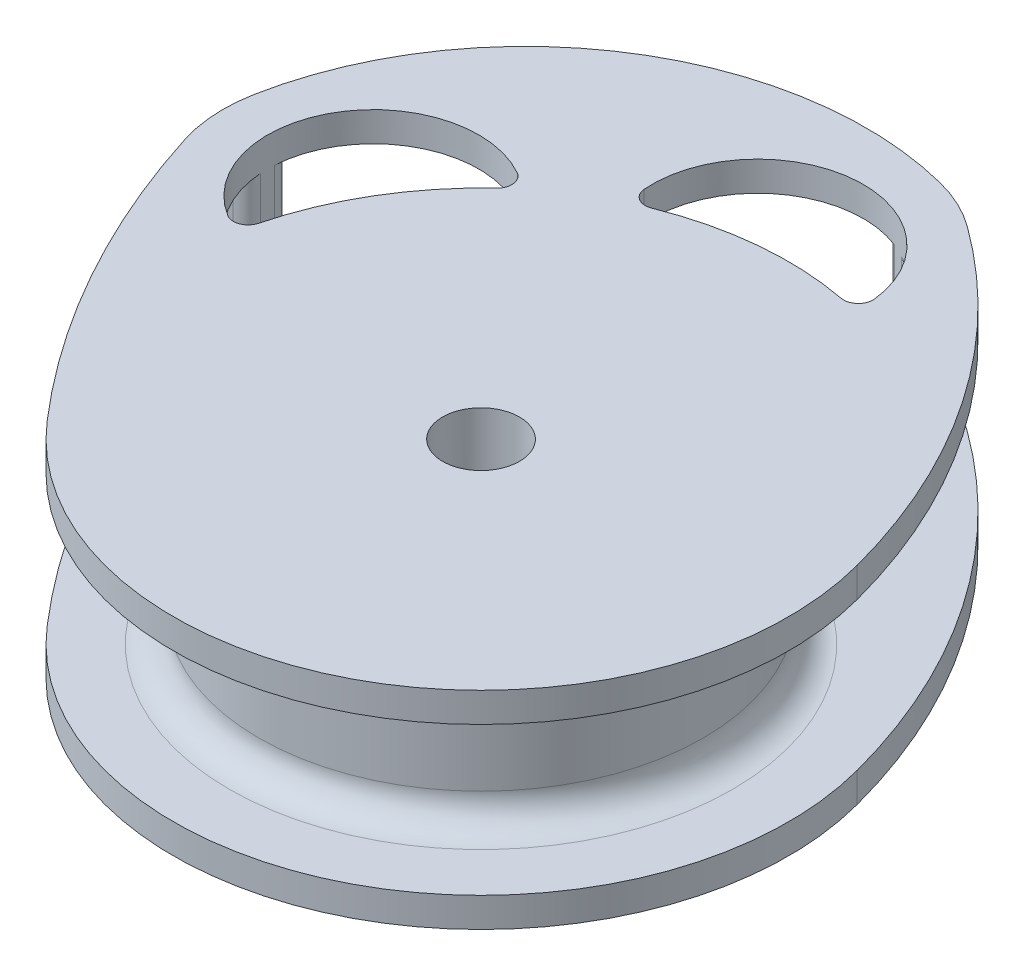
from build123d import *

# Parameters (mm, degrees)
BOSS_EXTRUDE1_DEPTH      = 8.889999999999999
BOSS_EXTRUDE1_DEPTH_BACK = 8.889999999999999
CUT_EXTRUDE1_DEPTH       = 6.35
CUT_EXTRUDE1_DEPTH_BACK  = 6.35
SKETCH2_OUTSIDE_W        = 82.456
SKETCH2_OUTSIDE_H        = 86.535
SKETCH2_OUTSIDE_R        = 19.05
FILLET2_R                = 2.5399999999999996
FILLET3_R                = 2.5399999999999996
CUT_EXTRUDE2_DEPTH       = 57.18088352838713
CUT_EXTRUDE2_DEPTH_BACK  = 57.18088352838713
SKETCH3_R                = 3.302
FILLET7_R                = 1.27
SKETCH4_R                = 2.799827725186126
BOSS_EXTRUDE2_DEPTH      = 12.700000000000001
FILLET8_R                = 1.27
FILLET9_R                = 1.27
BOSS_EXTRUDE3_DEPTH      = 12.700000000000001
FILLET10_R               = 1.27
FILLET11_R               = 1.27


with BuildPart() as part:
    # Sketch1 → Boss-Extrude1 (new, two sides: drawn at the far end of the back side and taken through both)
    with BuildSketch(Plane(origin=(0, 0, 0), x_dir=(1, 0, 0), z_dir=(0, 1, 0)).offset(-BOSS_EXTRUDE1_DEPTH_BACK)):
        with BuildLine():
            ThreePointArc((-19.961346299329247, -17.279083832009857), (12.343010670246805, -23.338212693982015), (25.51746676238168, 6.7735496001812106))
            ThreePointArc((25.51746676238168, 6.7735496001812106), (17.856305076007597, 23.48842949840264), (5.05140692053289, 36.683701061529106))
            ThreePointArc((5.05140692053289, 36.683701061529106), (2.9514880665036696, 37.92872057188535), (0.6543422069115673, 38.75507017975961))
            ThreePointArc((0.6543422069115673, 38.75507017975961), (-22.301676672407453, 35.102092028290805), (-35.36150911695426, 15.872847927621573))
            ThreePointArc((-35.36150911695426, 15.872847927621573), (-35.56679478351121, 12.698047208969147), (-34.987482180556434, 9.569805096199188))
            ThreePointArc((-34.987482180556434, 9.569805096199188), (-28.843528687703035, -4.62087218238063), (-19.961346299329247, -17.279083832009857))
        make_face()
        with BuildLine():
            ThreePointArc((-16.817771581171304, 20.351526802648387), (-30.512287440510388, 18.084055567022617), (-25.92678430393238, 4.982362874453683))
            ThreePointArc((-25.92678430393238, 4.982362874453683), (-22.711826531933053, 13.46086994732326), (-16.817771581171304, 20.351526802648387))
        make_face(mode=Mode.SUBTRACT)
        with BuildLine():
            ThreePointArc((6.504720373361617, 25.58731515848709), (-2.5364375136242097, 26.279051902510655), (-11.278396101192019, 23.870899973398274))
            ThreePointArc((-11.278396101192019, 23.870899973398274), (-3.4075863683522183, 35.30468957158116), (6.504720373361617, 25.58731515848709))
        make_face(mode=Mode.SUBTRACT)
    extrude(amount=BOSS_EXTRUDE1_DEPTH + BOSS_EXTRUDE1_DEPTH_BACK)

    # Sketch2 outside → Cut-Extrude1 (cut, two sides: drawn at the far end of the back side and taken through both)
    with BuildSketch(Plane(origin=(0, 0, 0), x_dir=(1, 0, 0), z_dir=(0, 1, 0)).offset(-CUT_EXTRUDE1_DEPTH_BACK)):
        with Locations((-4.594000000000001, 6.6335000000000015)):
            Rectangle(SKETCH2_OUTSIDE_W, SKETCH2_OUTSIDE_H)
        with Locations(Location((0, 0, 0), (0, 0, 270))):
            Circle(SKETCH2_OUTSIDE_R, mode=Mode.SUBTRACT)
    extrude(amount=CUT_EXTRUDE1_DEPTH + CUT_EXTRUDE1_DEPTH_BACK, mode=Mode.SUBTRACT)

    # Fillet2
    fillet2_edges = [part.edges().sort_by_distance(p)[0] for p in [
        (5.83e-15, -6.35, -19.05),
    ]]
    fillet(fillet2_edges, radius=FILLET2_R)

    # Fillet3
    fillet3_edges = [part.edges().sort_by_distance(p)[0] for p in [
        (5.83e-15, 6.35, -19.05),
    ]]
    fillet(fillet3_edges, radius=FILLET3_R)

    # Sketch3 → Cut-Extrude2 (cut, two sides: drawn at the far end of the back side and taken through both)
    with BuildSketch(Plane.XZ.offset(8.889999999999999).offset(-CUT_EXTRUDE2_DEPTH_BACK)):
        with Locations(Location((0, 0, 0), (0, 0, 270))):
            Circle(SKETCH3_R)
    extrude(amount=CUT_EXTRUDE2_DEPTH + CUT_EXTRUDE2_DEPTH_BACK, mode=Mode.SUBTRACT)

    # Fillet7
    fillet7_edges = [part.edges().sort_by_distance(p)[0] for p in [
        (-11.278396101192019, -7.619999999999999, -23.870899973398274),
        (6.504720373361618, -7.619999999999999, -25.587315158487094),
        (-16.8177715811713, -7.619999999999999, -20.35152680264839),
        (-25.92678430393238, -7.619999999999999, -4.982362874453684),
        (-16.8177715811713, 7.619999999999999, -20.35152680264839),
        (-25.92678430393238, 7.619999999999999, -4.982362874453684),
        (-11.278396101192019, 7.619999999999999, -23.870899973398274),
        (6.504720373361618, 7.619999999999999, -25.587315158487094),
    ]]
    fillet(fillet7_edges, radius=FILLET7_R)

    # Sketch4 → Boss-Extrude2 (add)
    with BuildSketch(Plane(origin=(0, -6.35, 0), x_dir=(1, 0, 0), z_dir=(0, 1, 0))):
        with Locations(Location((-19.545821536491868, 30.764468359069873, 0), (0, 0, 90))):
            Circle(SKETCH4_R)
    extrude(amount=BOSS_EXTRUDE2_DEPTH)

    # Fillet8
    fillet8_edges = [part.edges().sort_by_distance(p)[0] for p in [
        (-19.545821536491868, 6.350000000000001, -27.964640633883747),
    ]]
    fillet(fillet8_edges, radius=FILLET8_R)

    # Fillet9
    fillet9_edges = [part.edges().sort_by_distance(p)[0] for p in [
        (-19.545821536491868, -6.35, -27.964640633883747),
    ]]
    fillet(fillet9_edges, radius=FILLET9_R)

    # Sketch5 → Boss-Extrude3 (add)
    with BuildSketch(Plane(origin=(0, -6.35, 0), x_dir=(1, 0, 0), z_dir=(0, 1, 0))):
        with BuildLine():
            Line((5.051406920532894, 36.683701061529106), (2.806444454508407, 33.60535028129933))
            ThreePointArc((2.806444454508407, 33.60535028129933), (1.3278139057284792, 34.48201457635411), (-0.2896914738146051, 35.06387790494451))
            Line((-0.2896914738146051, 35.06387790494451), (0.6543422069115665, 38.75507017975961))
            ThreePointArc((0.6543422069115665, 38.75507017975961), (2.9514880665036722, 37.92872057188535), (5.051406920532894, 36.683701061529106))
        make_face()
        with BuildLine():
            Line((-35.3544815956292, 11.012323394849734), (-31.613987660206934, 11.736757739058502))
            ThreePointArc((-31.613987660206934, 11.736757739058502), (-31.779398631592027, 13.44775972519252), (-31.618935997945538, 15.159232871114584))
            Line((-31.618935997945538, 15.159232871114584), (-35.361509116954245, 15.872847927621565))
            ThreePointArc((-35.361509116954245, 15.872847927621565), (-35.589394649306776, 13.442251095808544), (-35.3544815956292, 11.012323394849734))
        make_face()
    extrude(amount=BOSS_EXTRUDE3_DEPTH)

    # Fillet10
    fillet10_edges = [part.edges().sort_by_distance(p)[0] for p in [
        (5.051406920532896, 8.9e-16, -36.683701061529106),
        (0.6543422069115669, 8.9e-16, -38.75507017975961),
        (-0.28969147381460514, 8.9e-16, -35.06387790494451),
        (2.8064444545084073, 8.9e-16, -33.60535028129933),
    ]]
    fillet(fillet10_edges, radius=FILLET10_R)

    # Fillet11
    fillet11_edges = [part.edges().sort_by_distance(p)[0] for p in [
        (-35.361509116954245, 8.9e-16, -15.872847927621565),
        (-35.3544815956292, 8.9e-16, -11.012323394849734),
        (-31.613987660206938, 8.9e-16, -11.736757739058502),
        (-31.61893599794554, 8.9e-16, -15.159232871114584),
    ]]
    fillet(fillet11_edges, radius=FILLET11_R)


solid = part.part
